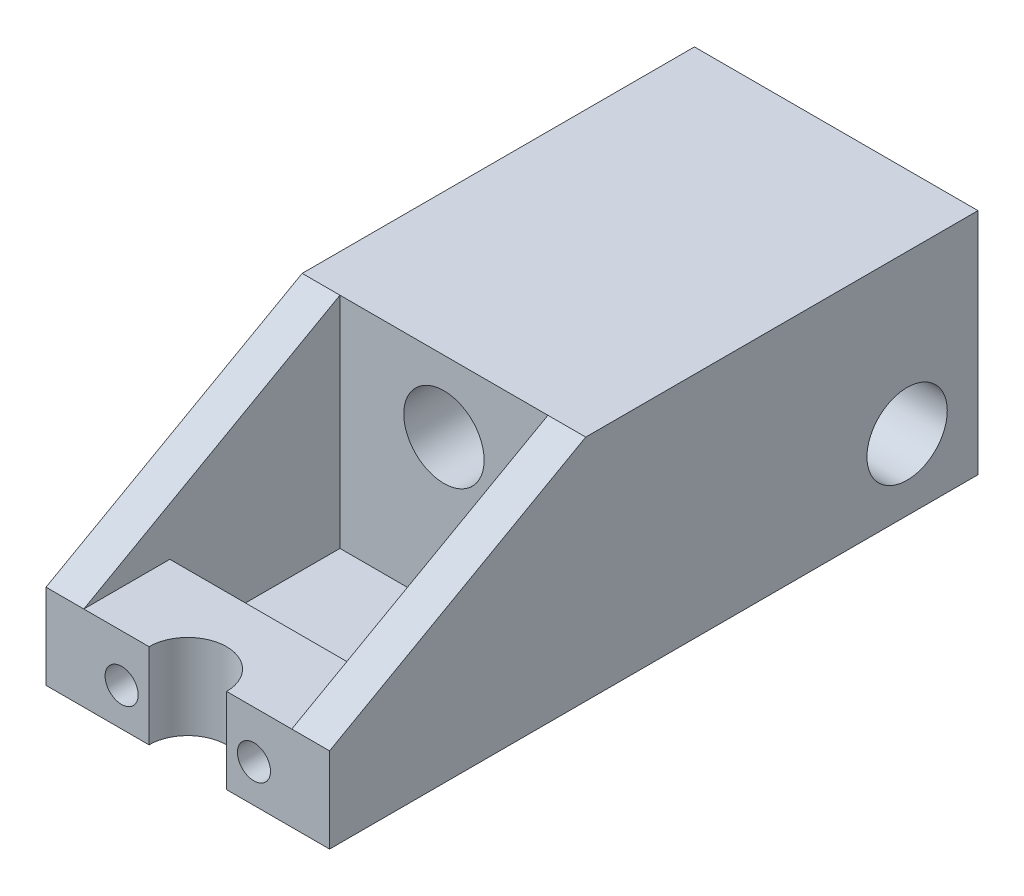
from build123d import *

# Parameters (mm, degrees)
SCHIZZO7_W                   = 30
SCHIZZO7_H                   = 24.2
SCHIZZO7_R                   = 4.25
ESTRUSIONE_ESTRUSIONE3_DEPTH = 7.5
TAGLIO_ESTRUSIONE1_REACH     = 35.206
SCHIZZO8_R                   = 4.25
SCHIZZO12_W                  = 30
SCHIZZO12_H                  = 9
ESTRUSIONE_ESTRUSIONE5_DEPTH = 53.6
TAGLIO_ESTRUSIONE3_REACH     = 66.724
SCHIZZO15_W                  = 22
SCHIZZO15_H                  = 18
TAGLIO_ESTRUSIONE4_DEPTH     = 8
TAGLIO_ESTRUSIONE5_REACH     = 73.256
SCHIZZO16_R                  = 1.75
TAGLIO_ESTRUSIONE6_DEPTH     = 3.1
SCHIZZO20_W                  = 30
SCHIZZO20_H                  = 15.2
SCHIZZO20_R                  = 4.25
ESTRUSIONE_ESTRUSIONE6_DEPTH = 26.5
ESTRUSIONE_ESTRUSIONE7_DEPTH = 4
ESTRUSIONE_ESTRUSIONE8_START = -4
ESTRUSIONE_ESTRUSIONE8_DEPTH = 4


with BuildPart() as part:
    # Schizzo7 → Estrusione-Estrusione3 (new, symmetric)
    with BuildSketch(Plane.XY):
        Rectangle(SCHIZZO7_W, SCHIZZO7_H)
        with Locations((0, 4.6)):
            Circle(SCHIZZO7_R, mode=Mode.SUBTRACT)
    extrude(amount=ESTRUSIONE_ESTRUSIONE3_DEPTH, both=True)

    # Schizzo8 → Taglio-Estrusione1 (cut, up to next)
    with BuildSketch(Plane(origin=(15, 0, 0), x_dir=(0, 0, -1), z_dir=(1, 0, 0)), mode=Mode.PRIVATE) as taglio_estrusione1_sk1:
        with Locations((0, -4.6)):
            Circle(SCHIZZO8_R)
    taglio_estrusione1_tool1 = extrude(taglio_estrusione1_sk1.sketch, amount=-TAGLIO_ESTRUSIONE1_REACH, mode=Mode.PRIVATE) & part.part
    add(taglio_estrusione1_tool1.solids().sort_by_distance((15, -4.6, 0))[0], mode=Mode.SUBTRACT)

    # Schizzo12 → Estrusione-Estrusione5 (add)
    with BuildSketch(Plane.XY.offset(7.5)):
        with Locations((0, -7.6)):
            Rectangle(SCHIZZO12_W, SCHIZZO12_H)
    extrude(amount=ESTRUSIONE_ESTRUSIONE5_DEPTH)

    # Schizzo14 → Taglio-Estrusione3 (cut, up to next)
    with BuildSketch(Plane(origin=(0, -3.1, 0), x_dir=(1, 0, 0), z_dir=(0, 1, 0)), mode=Mode.PRIVATE) as taglio_estrusione3_sk1:
        with BuildLine():
            Line((4.1, -61.1), (-4.1, -61.1))
            ThreePointArc((-4.1, -61.1), (0, -57), (4.1, -61.1))
        make_face()
    taglio_estrusione3_tool1 = extrude(taglio_estrusione3_sk1.sketch, amount=-TAGLIO_ESTRUSIONE3_REACH, mode=Mode.PRIVATE) & part.part
    add(taglio_estrusione3_tool1.solids().sort_by_distance((0, -3.1, 59.359906))[0], mode=Mode.SUBTRACT)

    # Schizzo15 → Taglio-Estrusione4 (cut)
    with BuildSketch(Plane(origin=(0, -3.1, 0), x_dir=(1, 0, 0), z_dir=(0, 1, 0))):
        with Locations((0, -43)):
            Rectangle(SCHIZZO15_W, SCHIZZO15_H)
    extrude(amount=-TAGLIO_ESTRUSIONE4_DEPTH, mode=Mode.SUBTRACT)

    # Schizzo16 → Taglio-Estrusione5 (cut, up to next)
    with BuildSketch(Plane.XY.offset(61.1), mode=Mode.PRIVATE) as taglio_estrusione5_sk1:
        with Locations((-7, -8.1)):
            Circle(SCHIZZO16_R)
    taglio_estrusione5_tool1 = extrude(taglio_estrusione5_sk1.sketch, amount=-TAGLIO_ESTRUSIONE5_REACH, mode=Mode.PRIVATE) & part.part
    # Schizzo16 → Taglio-Estrusione5 (cut, up to next)
    with BuildSketch(Plane.XY.offset(61.1), mode=Mode.PRIVATE) as taglio_estrusione5_sk2:
        with Locations((7, -8.1)):
            Circle(SCHIZZO16_R)
    taglio_estrusione5_tool2 = extrude(taglio_estrusione5_sk2.sketch, amount=-TAGLIO_ESTRUSIONE5_REACH, mode=Mode.PRIVATE) & part.part
    add(taglio_estrusione5_tool1.solids().sort_by_distance((-7, -8.1, 61.1))[0], mode=Mode.SUBTRACT)
    add(taglio_estrusione5_tool2.solids().sort_by_distance((7, -8.1, 61.1))[0], mode=Mode.SUBTRACT)

    # Schizzo17 → Taglio-Estrusione6 (cut)
    with BuildSketch(Plane(origin=(0, 0, 52), x_dir=(-1, 0, 0), z_dir=(0, 0, -1))):
        Polygon((-3.75, -8.1), (-5.375, -5.285417438), (-8.625, -5.285417438), (-10.25, -8.1), (-8.625, -10.914582562), (-5.375, -10.914582562), align=None)
        Polygon((5.375, -10.914582562), (3.75, -8.1), (5.375, -5.285417438), (8.625, -5.285417438), (10.25, -8.1), (8.625, -10.914582562), align=None)
    extrude(amount=-TAGLIO_ESTRUSIONE6_DEPTH, mode=Mode.SUBTRACT)

    # Schizzo20 → Estrusione-Estrusione6 (add)
    with BuildSketch(Plane.XY.offset(7.5)):
        with Locations((0, 4.5)):
            Rectangle(SCHIZZO20_W, SCHIZZO20_H)
        with Locations((0, 4.6)):
            Circle(SCHIZZO20_R, mode=Mode.SUBTRACT)
    extrude(amount=ESTRUSIONE_ESTRUSIONE6_DEPTH)

    # Schizzo21 → Estrusione-Estrusione7 (add)
    with BuildSketch(Plane.ZY.offset(15)):
        Polygon((34, 12.1), (61.1, -3.1), (34, -3.1), align=None)
    extrude(amount=-ESTRUSIONE_ESTRUSIONE7_DEPTH)

    # Schizzo22 → Estrusione-Estrusione8 (add)
    with BuildSketch(Plane(origin=(15, 0, 0), x_dir=(0, 0, -1), z_dir=(1, 0, 0)).offset(ESTRUSIONE_ESTRUSIONE8_START)):
        Polygon((-34, 12.1), (-61.1, -3.1), (-34, -3.1), align=None)
    extrude(amount=ESTRUSIONE_ESTRUSIONE8_DEPTH)


solid = part.part
